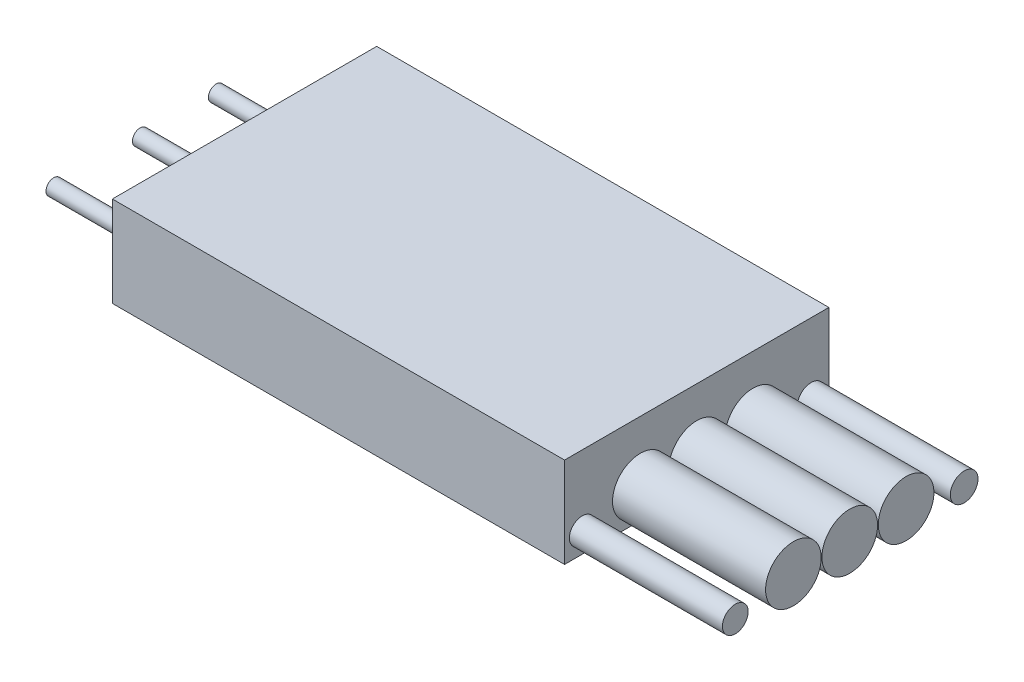
from build123d import *

# Parameters (mm, degrees)
SKETCH1_W           = 38
SKETCH1_H           = 13
BOSS_EXTRUDE1_DEPTH = 65
SKETCH2_R           = 1.848381342
SKETCH2_R_2         = 4
SKETCH2_R_3         = 1.991530231
BOSS_EXTRUDE4_DEPTH = 22
SKETCH3_R           = 1.118624503
BOSS_EXTRUDE5_DEPTH = 15


with BuildPart() as part:
    # Sketch1 → Boss-Extrude1 (new body)
    with BuildSketch(Plane(origin=(0, 0, 0), x_dir=(0, 0, -1), z_dir=(1, 0, 0))):
        Rectangle(SKETCH1_W, SKETCH1_H)
    extrude(amount=BOSS_EXTRUDE1_DEPTH)

    # Sketch2 → Boss-Extrude4 (add)
    with BuildSketch(Plane(origin=(65, 0, 0), x_dir=(0, 0, -1), z_dir=(1, 0, 0))):
        with Locations(Location((-16.455259224, -3.564649458, 0), (0, 0, 180))):
            Circle(SKETCH2_R)
        with Locations(Location((-8.1, -2.100713402, 0), (0, 0, 180))):
            Circle(SKETCH2_R_2)
        with Locations(Location((0, -2.100713402, 0), (0, 0, 180))):
            Circle(SKETCH2_R_2)
        with Locations(Location((8.1, -2.100713402, 0), (0, 0, 180))):
            Circle(SKETCH2_R_2)
        with Locations(Location((16.444267151, -3.564649458, 0), (0, 0, 180))):
            Circle(SKETCH2_R_3)
    extrude(amount=BOSS_EXTRUDE4_DEPTH)

    # Sketch3 → Boss-Extrude5 (add)
    with BuildSketch(Plane.ZY):
        with Locations((-10.926639498, -2.758613366)):
            Circle(SKETCH3_R)
        with Locations((0, -2.758613366)):
            Circle(SKETCH3_R)
        with Locations((12.420208926, -2.758613366)):
            Circle(SKETCH3_R)
    extrude(amount=BOSS_EXTRUDE5_DEPTH)


solid = part.part
